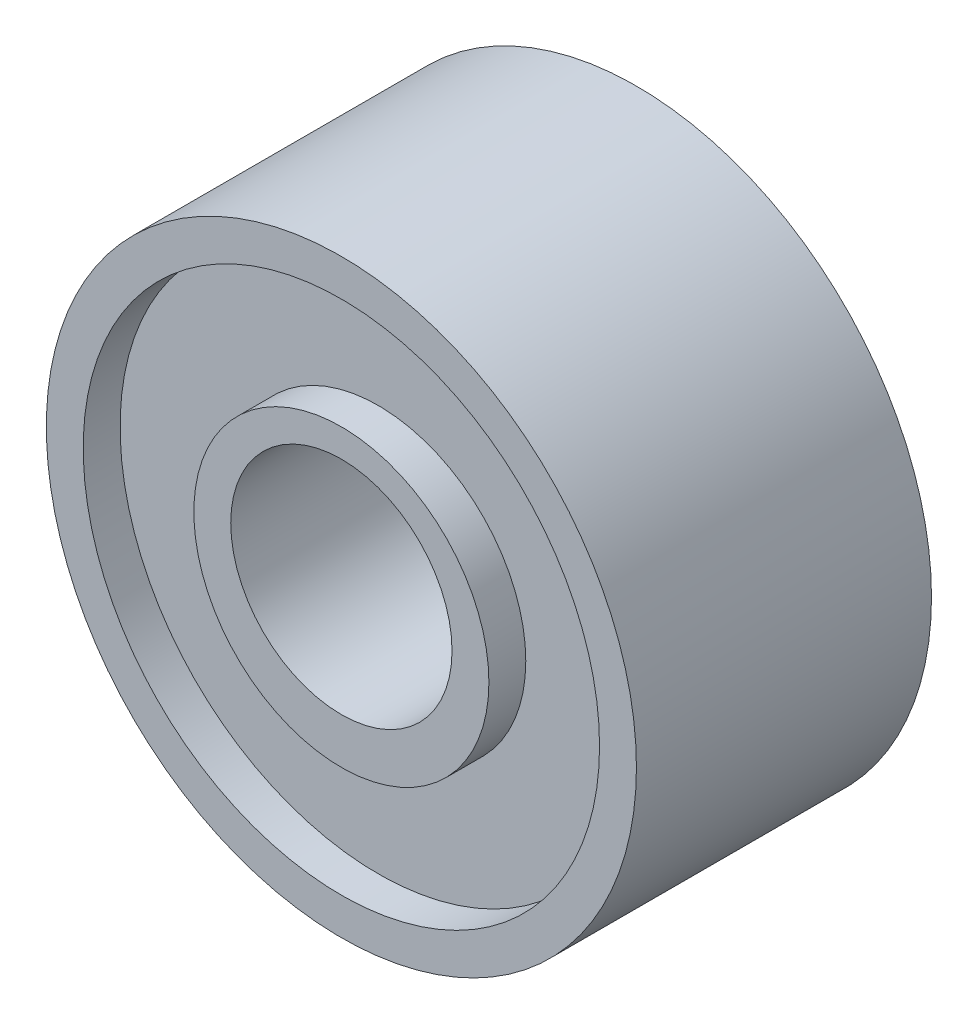
from build123d import *

# Parameters (mm, degrees)
SKETCH1_R           = 4
SKETCH1_R_2         = 1.5
BOSS_EXTRUDE2_DEPTH = 4
SKETCH3_R           = 3.5
SKETCH3_R_2         = 2
CUT_EXTRUDE1_DEPTH  = 0.5
CUT_EXTRUDE2_START  = -0.5
SKETCH4_R           = 3.5
SKETCH4_R_2         = 2
CUT_EXTRUDE2_DEPTH  = 0.5


with BuildPart() as part:
    # Sketch1 → Boss-Extrude2 (new body)
    with BuildSketch(Plane.XY):
        Circle(SKETCH1_R)
        with Locations((0, 0.120165435)):
            Circle(SKETCH1_R_2, mode=Mode.SUBTRACT)
    extrude(amount=BOSS_EXTRUDE2_DEPTH)

    # Sketch3 → Cut-Extrude1 (cut)
    with BuildSketch(Plane.XY.offset(4)):
        Circle(SKETCH3_R)
        Circle(SKETCH3_R_2, mode=Mode.SUBTRACT)
    extrude(amount=-CUT_EXTRUDE1_DEPTH, mode=Mode.SUBTRACT)

    # Sketch4 → Cut-Extrude2 (cut)
    with BuildSketch(Plane(origin=(0, 0, 0), x_dir=(-1, 0, 0), z_dir=(0, 0, -1)).offset(CUT_EXTRUDE2_START)):
        with Locations(Location((0, 0, 0), (0, 0, 180))):
            Circle(SKETCH4_R)
        with Locations(Location((0, 0, 0), (0, 0, 180))):
            Circle(SKETCH4_R_2, mode=Mode.SUBTRACT)
    extrude(amount=CUT_EXTRUDE2_DEPTH, mode=Mode.SUBTRACT)


solid = part.part
